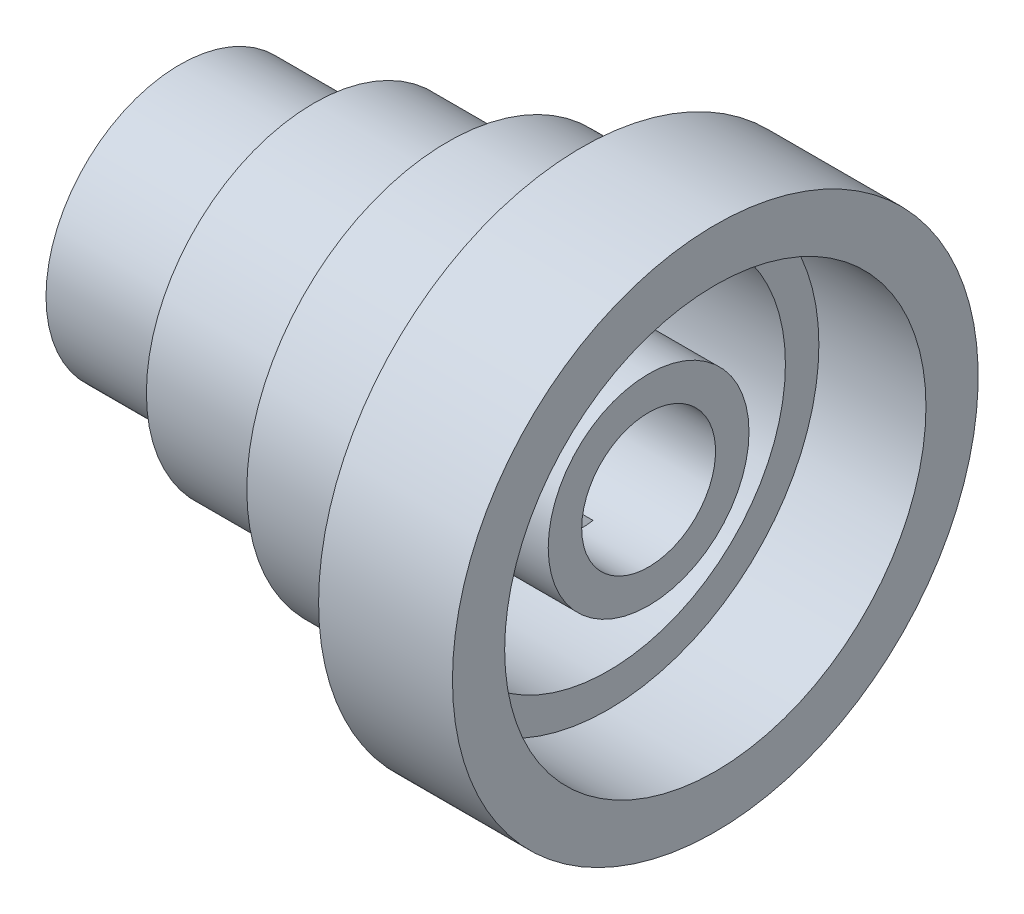
from build123d import *

# Parameters (mm, degrees)
CUT_EXTRUDE2_DEPTH = 120


with BuildPart() as part:
    # Sketch1 → Revolve1 (revolve)
    with BuildSketch(Plane(origin=(0, 0, 0), x_dir=(1, 0, 0), z_dir=(0, 1, 0)), mode=Mode.PRIVATE) as revolve1_sk:
        Polygon((-87.474048443, 20), (52.595155709, 20), (52.595155709, 30), (-39.474048443, 30), (-39.474048443, 40), (0.525951557, 40), (0.525951557, 52.948096886), (40.525951557, 52.948096886), (40.525951557, 62.948096886), (72.525951557, 62.948096886), (72.525951557, 78.546712803), (32.525951557, 78.546712803), (32.525951557, 60), (-7.474048443, 60), (-7.474048443, 50), (-47.474048443, 50), (-47.474048443, 40), (-87.474048443, 40), align=None)
    revolve(revolve1_sk.sketch.rotate(Axis((-87.474048443, 0, 0), (1, 0, 0)), 180), axis=Axis((-87.474048443, 0, 0), (1, 0, 0)))

    # Sketch2 → Cut-Extrude2 (cut)
    with BuildSketch(Plane.ZY.offset(87.474048443)):
        Polygon((-3.470245106, -25.786795459), (-3.470245106, -19.696634202), (6.863316134, -18.785496843), (6.863316134, -25.786795459), align=None)
    extrude(amount=-CUT_EXTRUDE2_DEPTH, mode=Mode.SUBTRACT)


solid = part.part
